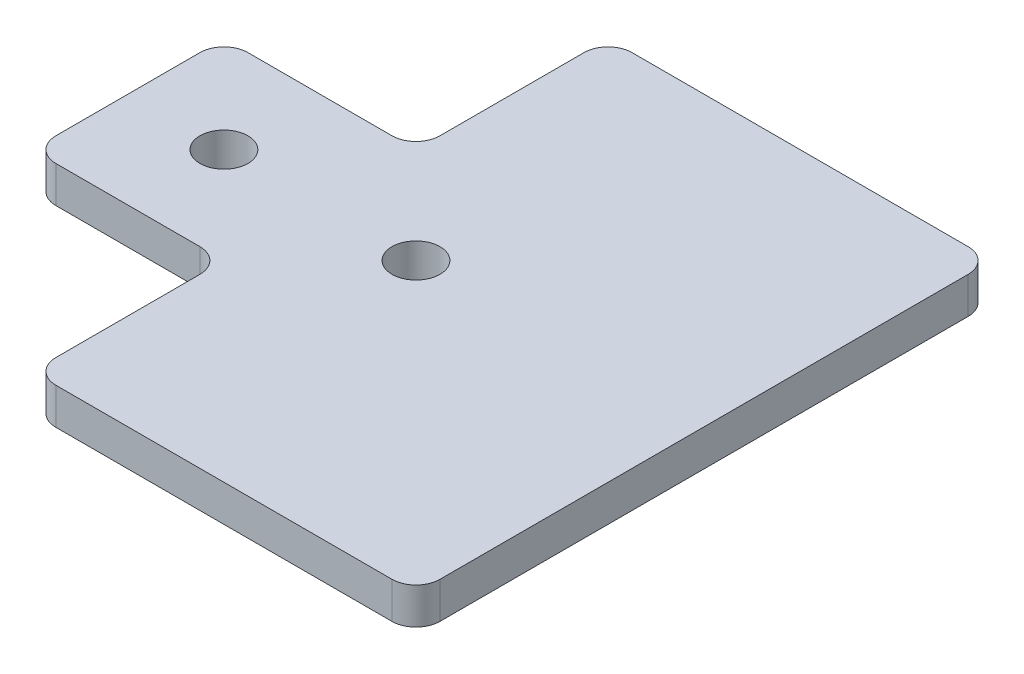
from build123d import *

# Parameters (mm, degrees)
BOSS_EXTRUDE1_DEPTH = 4.826
FILLET1_R           = 3.175
SKETCH2_R           = 3.175
CUT_EXTRUDE1_DEPTH  = 64.68312395


with BuildPart() as part:
    # Sketch1 → Boss-Extrude1 (new body)
    with BuildSketch(Plane(origin=(0, 0, 0), x_dir=(1, 0, 0), z_dir=(0, 1, 0))):
        Polygon((-25.4, 38.1), (-25.4, 12.7), (-50.8, 12.7), (-50.8, -12.7), (-25.4, -12.7), (-25.4, -38.1), (25.4, -38.1), (25.4, 38.1), align=None)
    extrude(amount=BOSS_EXTRUDE1_DEPTH)

    # Fillet1
    fillet1_edges = [part.edges().sort_by_distance(p)[0] for p in [
        (25.4, 2.413, -38.1),
        (25.4, 2.413, 38.1),
        (-25.4, 2.413, 38.1),
        (-25.4, 2.413, 12.7),
        (-50.8, 2.413, 12.7),
        (-50.8, 2.413, -12.7),
        (-25.4, 2.413, -12.7),
        (-25.4, 2.413, -38.1),
    ]]
    fillet(fillet1_edges, radius=FILLET1_R)

    # Sketch2 → Cut-Extrude1 (cut, through all)
    with BuildSketch(Plane(origin=(0, 4.826, 0), x_dir=(1, 0, 0), z_dir=(0, 1, 0))):
        with Locations(Location((-38.1, 0, 0), (0, 0, 270))):
            Circle(SKETCH2_R)
        with Locations(Location((-12.7, 0, 0), (0, 0, 270))):
            Circle(SKETCH2_R)
    extrude(amount=-CUT_EXTRUDE1_DEPTH, mode=Mode.SUBTRACT)


solid = part.part
